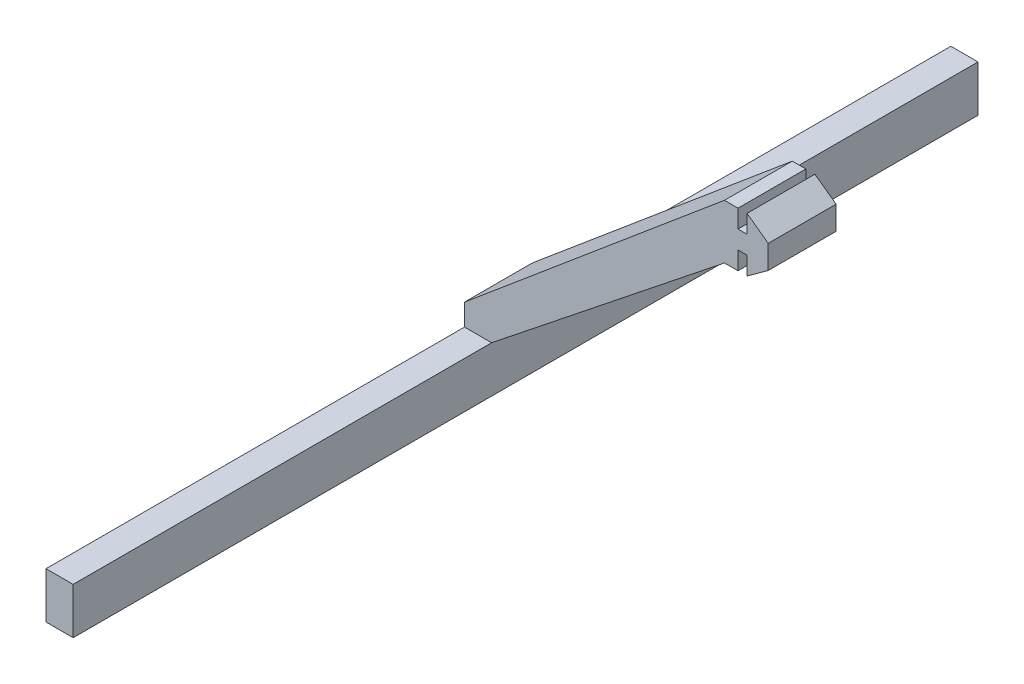
from build123d import *

# Parameters (mm, degrees)
BOSS_EXTRU_1_DEPTH = 15
ESQUISSE3_W        = 15
ESQUISSE3_H        = 4
BOSS_EXTRU_2_DEPTH = 2
ESQUISSE4_W        = 15
ESQUISSE4_H        = 12
BOSS_EXTRU_3_DEPTH = 3
BOSS_EXTRU_4_DEPTH = 15
ESQUISSE6_W        = 6
ESQUISSE6_H        = 15
BOSS_EXTRU_5_DEPTH = 15
BOSS_EXTRU_6_DEPTH = 15
ESQUISSE8_W        = 200
ESQUISSE8_H        = 10.22
BOSS_EXTRU_7_DEPTH = 6


with BuildPart() as part:
    # Esquisse1 → Boss.-Extru.1 (new body)
    with BuildSketch(Plane.XY):
        Polygon((0, 4.759390863), (4.68, 1.359390863), (4.68, -3.840609137), (0, -7.240609137), align=None)
    extrude(amount=BOSS_EXTRU_1_DEPTH)

    # Esquisse3 → Boss.-Extru.2 (add)
    with BuildSketch(Plane.ZY):
        with Locations((7.5, -1.240609137)):
            Rectangle(ESQUISSE3_W, ESQUISSE3_H)
    extrude(amount=BOSS_EXTRU_2_DEPTH)

    # Esquisse4 → Boss.-Extru.3 (add)
    with BuildSketch(Plane.ZY.offset(2)):
        with Locations((7.5, -1.240609137)):
            Rectangle(ESQUISSE4_W, ESQUISSE4_H)
    extrude(amount=BOSS_EXTRU_3_DEPTH)

    # Esquisse5 → Boss.-Extru.4 (add)
    with BuildSketch(Plane(origin=(0, 0, 0), x_dir=(-1, 0, 0), z_dir=(0, 0, -1))):
        Polygon((5, 4.759390863), (62.453333234, -43.449679864), (50.453333234, -43.449679864), (5, -7.240609137), align=None)
    extrude(amount=-BOSS_EXTRU_4_DEPTH)

    # Esquisse6 → Boss.-Extru.5 (add)
    with BuildSketch(Plane(origin=(0, -43.449679864, 0), x_dir=(-1, 0, 0), z_dir=(0, -1, 0))):
        with Locations((59.453333234, -7.5)):
            Rectangle(ESQUISSE6_W, ESQUISSE6_H)
    extrude(amount=BOSS_EXTRU_5_DEPTH)

    # Esquisse7 → Boss.-Extru.6 (add)
    with BuildSketch(Plane(origin=(0, 0, 0), x_dir=(-1, 0, 0), z_dir=(0, 0, -1))):
        Polygon((50.453333234, -43.449679864), (56.453333234, -48.229404669), (56.453333234, -43.449679864), align=None)
    extrude(amount=-BOSS_EXTRU_6_DEPTH)

    # Esquisse8 → Boss.-Extru.7 (add)
    with BuildSketch(Plane.ZY.offset(62.453333234)):
        with Locations((7.5, -53.339679864)):
            Rectangle(ESQUISSE8_W, ESQUISSE8_H)
    extrude(amount=-BOSS_EXTRU_7_DEPTH)


solid = part.part
